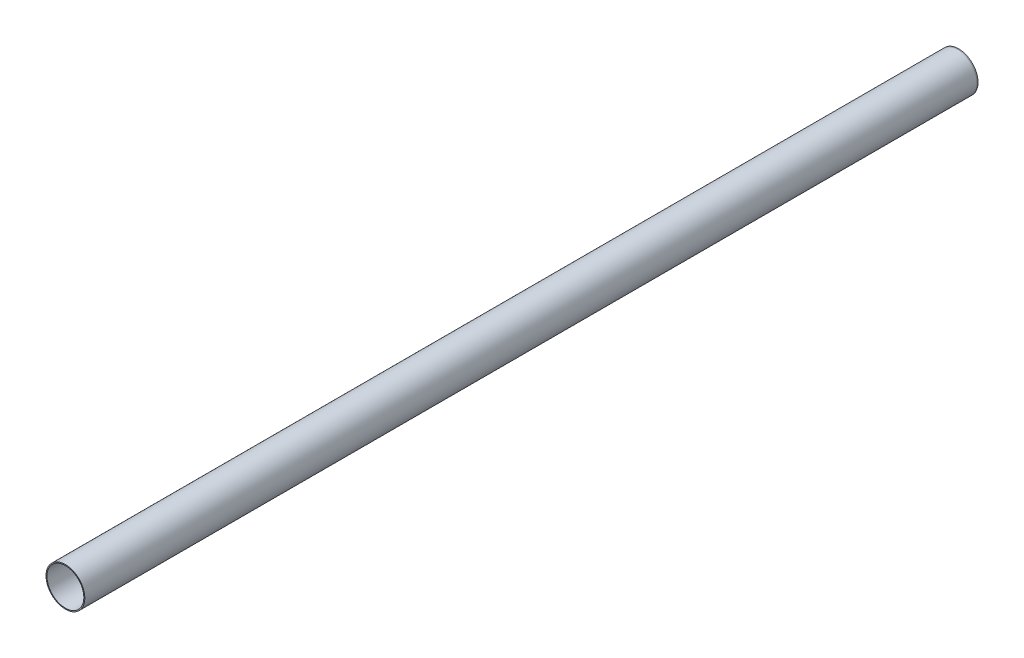
from build123d import *

# Parameters (mm, degrees)
SKETCH11_R              = 10
SKETCH11_R_2            = 9.5
PIPE_26_9_X_3_2_1_DEPTH = 460
SKETCH13_R              = 10
BOSS_EXTRUDE2_DEPTH     = 0.5


with BuildPart() as part:
    # Sketch11 → Pipe 26.9 X 3.2(1) (new body)
    with BuildSketch(Plane(origin=(0, 0, 0), x_dir=(-1, 0, 0), z_dir=(0, 0, -1))):
        Circle(SKETCH11_R)
        Circle(SKETCH11_R_2, mode=Mode.SUBTRACT)
    extrude(amount=PIPE_26_9_X_3_2_1_DEPTH)


with BuildPart() as body_2:
    # Sketch13 → Boss-Extrude2 (new body)
    with BuildSketch(Plane(origin=(0, 0, -460), x_dir=(-1, 0, 0), z_dir=(0, 0, -1))):
        Circle(SKETCH13_R)
    extrude(amount=BOSS_EXTRUDE2_DEPTH)


solid = Compound([part.part, body_2.part])
